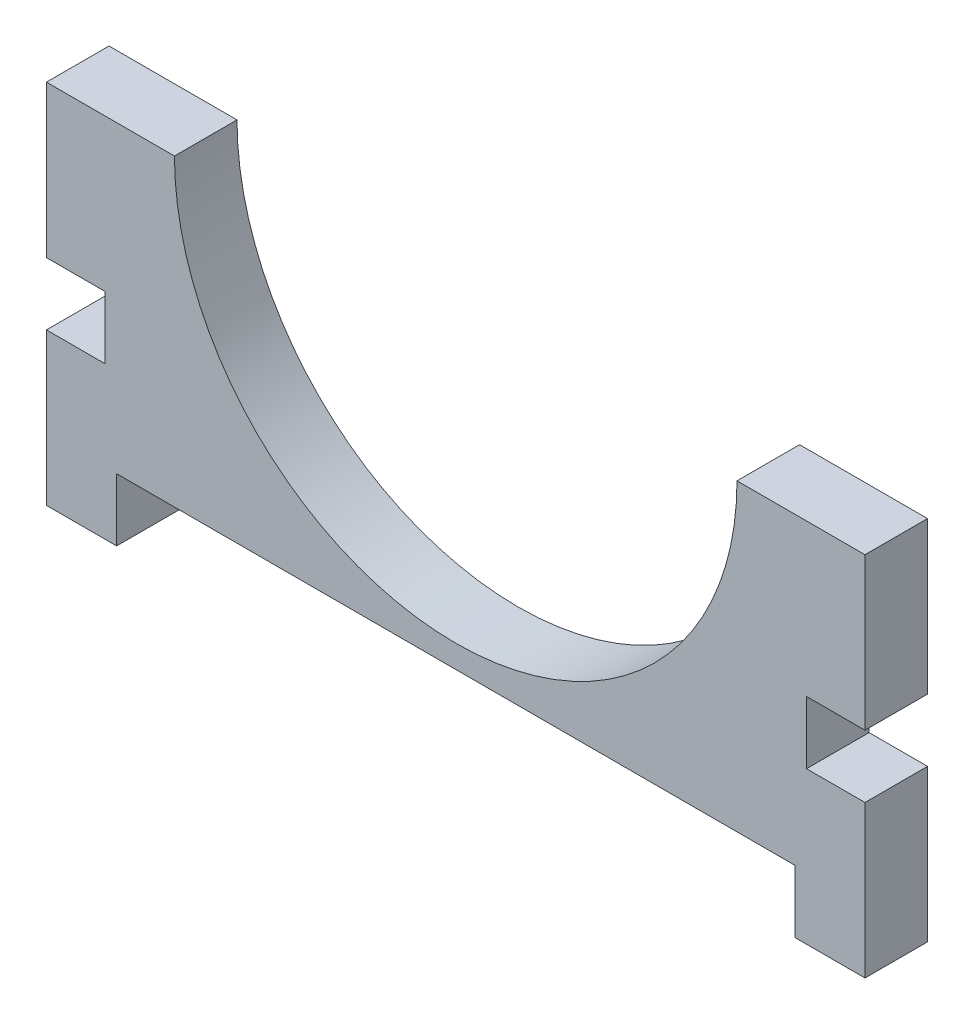
from build123d import *

# Parameters (mm, degrees)
BOSS_EXTRUDE1_DEPTH = 5.35


with BuildPart() as part:
    # Model → Boss-Extrude1 (new body)
    with BuildSketch(Plane.XY):
        with BuildLine():
            Line((59.055, 31.35), (70, 31.35))
            Line((70, 31.35), (70, 18.35))
            Line((70, 18.35), (65, 18.35))
            Line((65, 18.35), (65, 13))
            Line((65, 13), (70, 13))
            Line((70, 13), (70, 0))
            Line((70, 0), (64, 0))
            Line((64, 0), (64, 5.35))
            Line((64, 5.35), (6, 5.35))
            Line((6, 5.35), (6, 0))
            Line((6, 0), (0, 0))
            Line((0, 0), (0, 13))
            Line((0, 13), (5, 13))
            Line((5, 13), (5, 18.35))
            Line((5, 18.35), (0, 18.35))
            Line((0, 18.35), (0, 31.35))
            Line((0, 31.35), (10.945, 31.35))
            ThreePointArc((10.945, 31.35), (35, 7.295), (59.055, 31.35))
        make_face()
    extrude(amount=BOSS_EXTRUDE1_DEPTH)


solid = part.part
